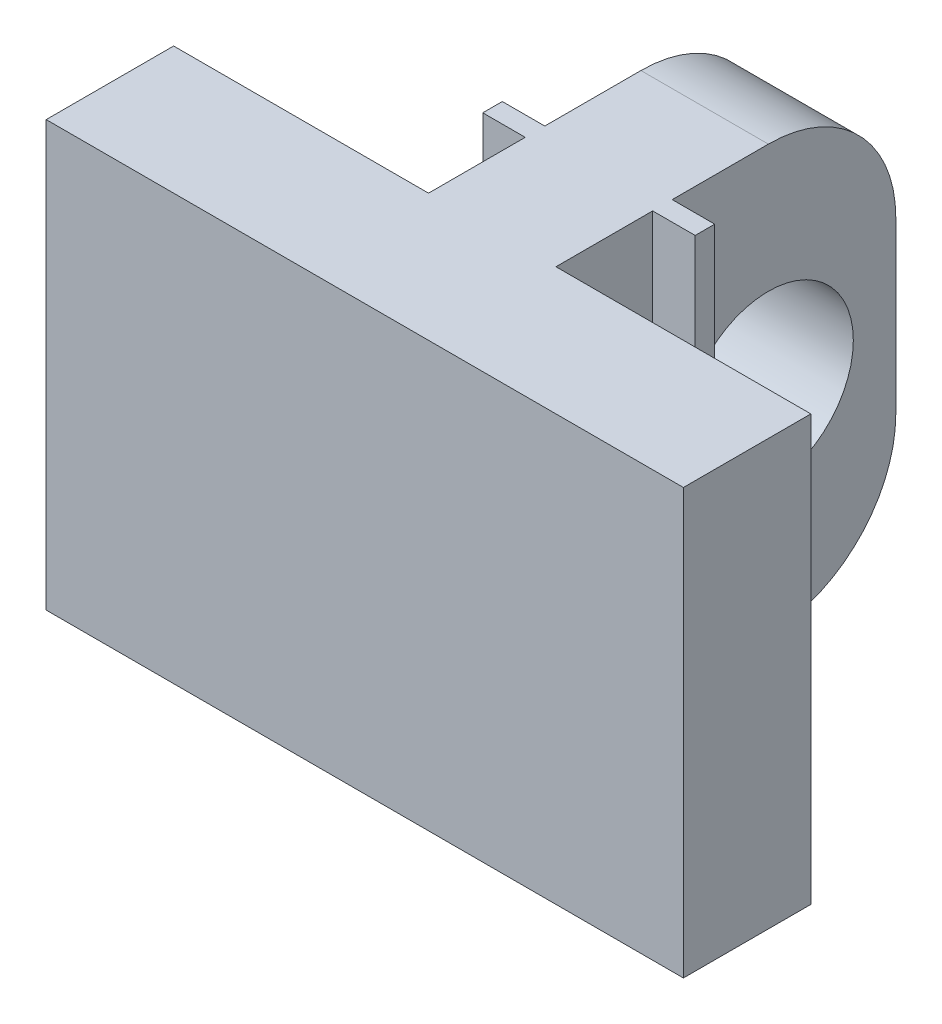
from build123d import *

# Parameters (mm, degrees)
BOSS_EXTRUDE1_DEPTH      = 10
FILLET1_R                = 3
SKETCH2_R                = 2
CUT_EXTRUDE1_DEPTH       = 10
BOSS_EXTRUDE2_DEPTH      = 1
BOSS_EXTRUDE2_DEPTH_BACK = 4
SKETCH3_W                = 0.460053571
SKETCH3_H                = 10


with BuildPart() as part:
    # Sketch1 → Boss-Extrude1 (new body)
    with BuildSketch(Plane(origin=(0, 0, 0), x_dir=(1, 0, 0), z_dir=(0, 1, 0))):
        Polygon((1.5, 7.685676393), (-1.5, 7.685676393), (-1.5, -0.314323607), (-7.5, -0.314323607), (-7.5, -3.314323607), (7.5, -3.314323607), (7.5, -0.314323607), (1.5, -0.314323607), align=None)
    extrude(amount=BOSS_EXTRUDE1_DEPTH)

    # Fillet1
    fillet1_edges = [part.edges().sort_by_distance(p)[0] for p in [
        (0, 0, -7.685676393),
        (0, 10, -7.685676393),
    ]]
    fillet(fillet1_edges, radius=FILLET1_R)

    # Sketch2 → Cut-Extrude1 (cut)
    with BuildSketch(Plane(origin=(1.5, 0, 0), x_dir=(0, 0, -1), z_dir=(1, 0, 0))):
        with Locations((4.685676393, 5)):
            Circle(SKETCH2_R)
    extrude(amount=-CUT_EXTRUDE1_DEPTH, mode=Mode.SUBTRACT)

    # Sketch3 → Boss-Extrude2 (add, two sides: drawn at the far end of the back side and taken through both)
    with BuildSketch(Plane(origin=(1.5, 0, 0), x_dir=(0, 0, -1), z_dir=(1, 0, 0)).offset(-BOSS_EXTRUDE2_DEPTH_BACK)):
        with Locations((2.192380635, 5)):
            Rectangle(SKETCH3_W, SKETCH3_H)
    extrude(amount=BOSS_EXTRUDE2_DEPTH + BOSS_EXTRUDE2_DEPTH_BACK)


solid = part.part
